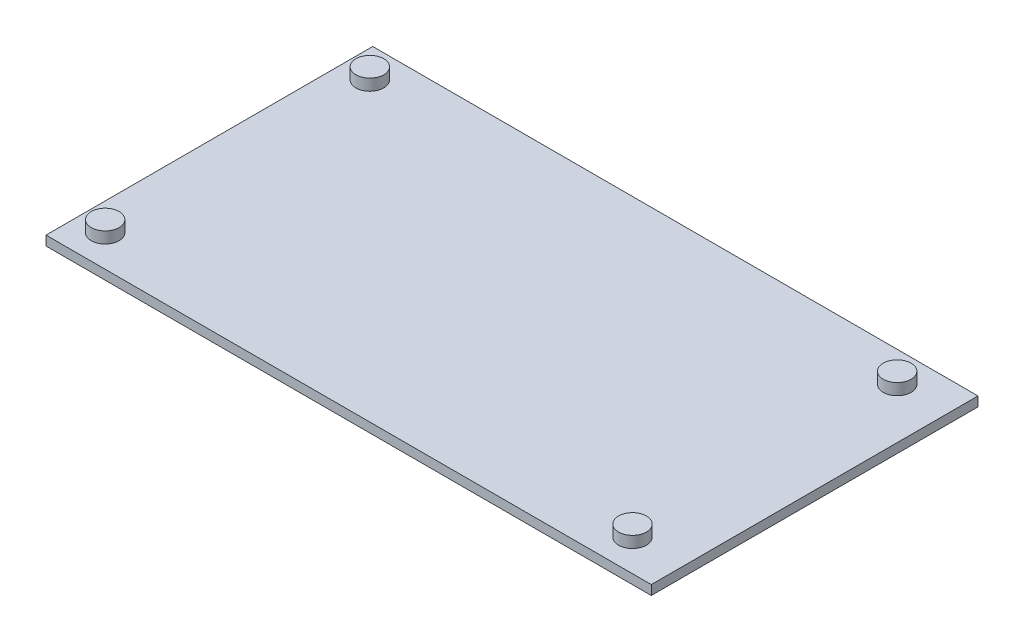
from build123d import *

# Parameters (mm, degrees)
SKETCH1_W           = 95.6
SKETCH1_H           = 51.6
BOSS_EXTRUDE1_DEPTH = 1.5
SKETCH2_R           = 2.2
BOSS_EXTRUDE2_DEPTH = 1.8


with BuildPart() as part:
    # Sketch1 → Boss-Extrude1 (new body)
    with BuildSketch(Plane.XZ.offset(1)):
        with Locations((0, 36)):
            Rectangle(SKETCH1_W, SKETCH1_H)
    extrude(amount=BOSS_EXTRUDE1_DEPTH)

    # Sketch2 → Boss-Extrude2 (add)
    with BuildSketch(Plane(origin=(0, -1, 0), x_dir=(1, 0, 0), z_dir=(0, 1, 0))):
        with Locations((-43.453932042, -56.8)):
            Circle(SKETCH2_R)
        with Locations((-43.453932042, -15)):
            Circle(SKETCH2_R)
        with Locations((39.832771039, -15)):
            Circle(SKETCH2_R)
        with Locations((39.832771039, -56.8)):
            Circle(SKETCH2_R)
    extrude(amount=BOSS_EXTRUDE2_DEPTH)


solid = part.part
